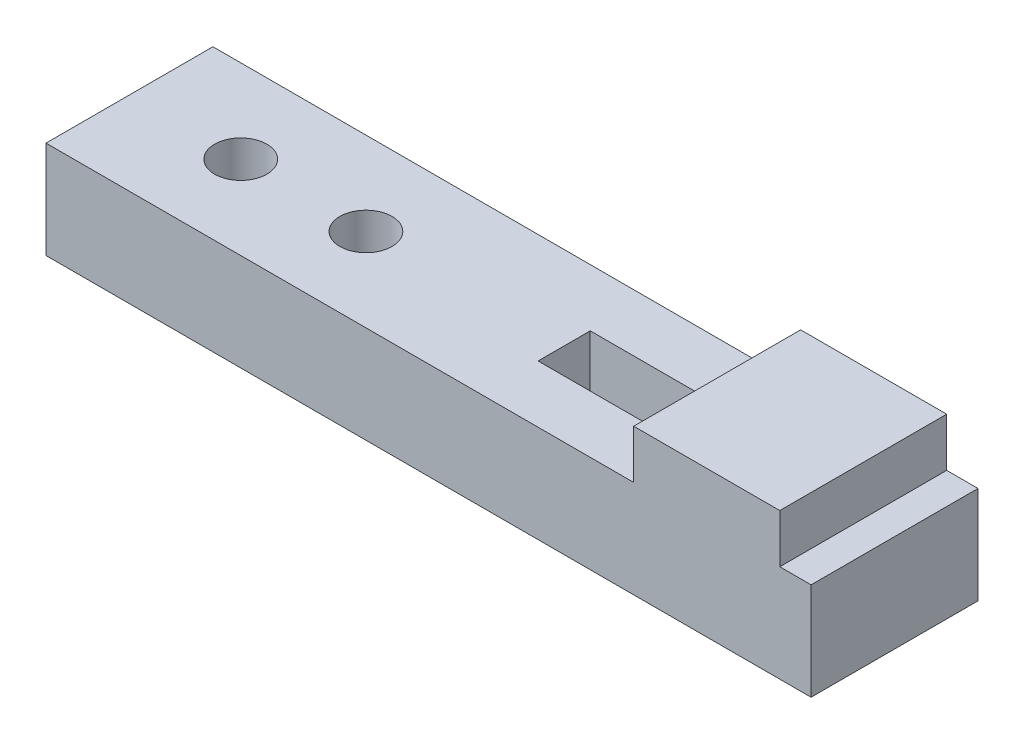
from build123d import *

# Parameters (mm, degrees)
F_01_BASE_PROFILE_W           = 220
F_01_BASE_PROFILE_H           = 48
F_01_BASE_PROFILE_R           = 7.5
F_01_BASE_PROFILE_W_2         = 60
F_01_BASE_PROFILE_H_2         = 15
F_01_BASE_EXTRUDE_DEPTH       = 28
F_02_BOSS_PROFILE_W           = 42
F_02_BOSS_PROFILE_H           = 48
F_02_REINFORCEMENT_BOSS_DEPTH = 42


with BuildPart() as part:
    # 01_Base_Profile → 01_Base_Extrude (new body)
    with BuildSketch(Plane(origin=(0, 0, 0), x_dir=(1, 0, 0), z_dir=(0, 1, 0))):
        Rectangle(F_01_BASE_PROFILE_W, F_01_BASE_PROFILE_H)
        with Locations(Location((-78, 0, 0), (0, 0, 270))):
            Circle(F_01_BASE_PROFILE_R, mode=Mode.SUBTRACT)
        with Locations(Location((-42, 0, 0), (0, 0, 270))):
            Circle(F_01_BASE_PROFILE_R, mode=Mode.SUBTRACT)
        with Locations((45, 0)):
            Rectangle(F_01_BASE_PROFILE_W_2, F_01_BASE_PROFILE_H_2, mode=Mode.SUBTRACT)
    extrude(amount=F_01_BASE_EXTRUDE_DEPTH)

    # 02_Boss_Profile → 02_Reinforcement_Boss (add)
    with BuildSketch(Plane(origin=(0, 0, 0), x_dir=(1, 0, 0), z_dir=(0, 1, 0))):
        with Locations((80, 0)):
            Rectangle(F_02_BOSS_PROFILE_W, F_02_BOSS_PROFILE_H)
    extrude(amount=F_02_REINFORCEMENT_BOSS_DEPTH)


solid = part.part
